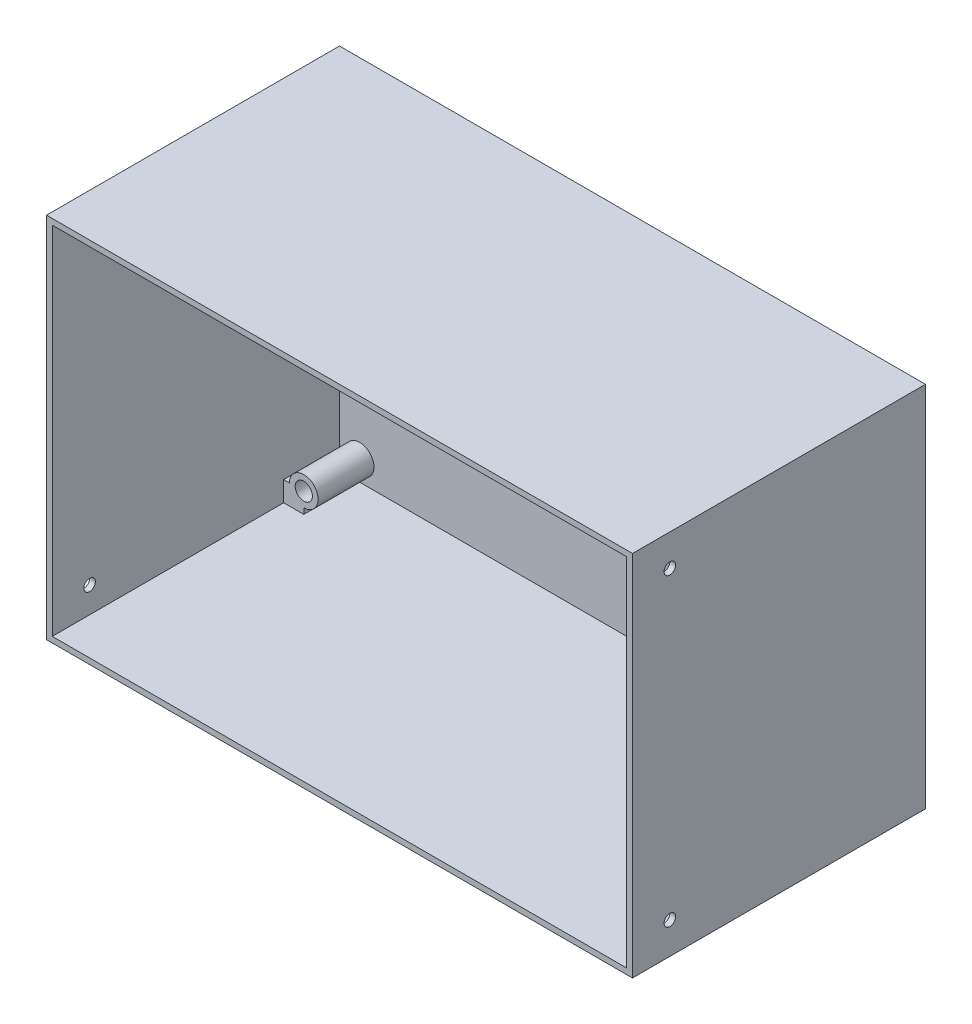
from build123d import *

# Parameters (mm, degrees)
SKETCH_1_W               = 102
SKETCH_1_H               = 64
EXTRUDE_1_DEPTH          = 50
SKETCH_1_3_R             = 1.5
EXTRUDE_2_DEPTH          = 9.72
SKETCH_4_W               = 102
SKETCH_4_H               = 1
EXTRUDE_3_DEPTH          = 64
SKETCH_1_5_W             = 76
SKETCH_1_5_H             = 25.8
CUT_EXTRUDE_1_DEPTH      = 1
CUT_EXTRUDE_2_DEPTH      = 102
CUT_EXTRUDE_2_DEPTH_BACK = 1
SKETCH_5_R               = 1


with BuildPart() as part:
    # Эскиз1 → Бобышка-Вытянуть1 (new body)
    with BuildSketch(Plane.XY):
        with Locations((53, 34)):
            Rectangle(SKETCH_1_W, SKETCH_1_H)
        Polygon((3, 61.5), (3, 65), (6.5, 65), (99.5, 65), (103, 65), (103, 61.5), (103, 6.5), (103, 3), (99.5, 3), (6.5, 3), (3, 3), (3, 6.5), align=None, mode=Mode.SUBTRACT)
    extrude(amount=EXTRUDE_1_DEPTH)

    # Эскиз1<3> → Бобышка-Вытянуть2 (add)
    # profile 1 of 4: a face of its own
    with BuildSketch(Plane.XY):
        with BuildLine():
            Line((6.5, 65), (3, 65))
            Line((3, 65), (3, 61.5))
            Line((3, 61.5), (4, 61.5))
            ThreePointArc((4, 61.5), (8.267766953, 59.732233047), (6.5, 64))
            Line((6.5, 64), (6.5, 65))
        make_face()
        with Locations((6.5, 61.5)):
            Circle(SKETCH_1_3_R, mode=Mode.SUBTRACT)
    # profile 2 of 4: a face of its own
    with BuildSketch(Plane.XY):
        with BuildLine():
            Line((103, 65), (99.5, 65))
            Line((99.5, 65), (99.5, 64))
            ThreePointArc((99.5, 64), (97.732233047, 59.732233047), (102, 61.5))
            Line((102, 61.5), (103, 61.5))
            Line((103, 61.5), (103, 65))
        make_face()
        with Locations((99.5, 61.5)):
            Circle(SKETCH_1_3_R, mode=Mode.SUBTRACT)
    # profile 3 of 4: a face of its own
    with BuildSketch(Plane.XY):
        with BuildLine():
            Line((4, 6.5), (3, 6.5))
            Line((3, 6.5), (3, 3))
            Line((3, 3), (6.5, 3))
            Line((6.5, 3), (6.5, 4))
            ThreePointArc((6.5, 4), (8.267766953, 8.267766953), (4, 6.5))
        make_face()
        with Locations((6.5, 6.5)):
            Circle(SKETCH_1_3_R, mode=Mode.SUBTRACT)
    # profile 4 of 4: a face of its own
    with BuildSketch(Plane.XY):
        with BuildLine():
            Line((103, 3), (103, 6.5))
            Line((103, 6.5), (102, 6.5))
            ThreePointArc((102, 6.5), (97.732233047, 8.267766953), (99.5, 4))
            Line((99.5, 4), (99.5, 3))
            Line((99.5, 3), (103, 3))
        make_face()
        with Locations((99.5, 6.5)):
            Circle(SKETCH_1_3_R, mode=Mode.SUBTRACT)
    extrude(amount=EXTRUDE_2_DEPTH)

    # Эскиз4 → Бобышка-Вытянуть3 (add)
    with BuildSketch(Plane(origin=(0, 66, 0), x_dir=(1, 0, 0), z_dir=(0, 1, 0))):
        with Locations((53, 0.5)):
            Rectangle(SKETCH_4_W, SKETCH_4_H)
    extrude(amount=-EXTRUDE_3_DEPTH)

    # Эскиз1<5> → Вырез-Вытянуть1 (cut)
    with BuildSketch(Plane.XY):
        with Locations((53, 34)):
            Rectangle(SKETCH_1_5_W, SKETCH_1_5_H)
    extrude(amount=-CUT_EXTRUDE_1_DEPTH, mode=Mode.SUBTRACT)

    # Эскиз5 → Вырез-Вытянуть2 (cut, two sides: drawn at the far end of the back side and taken through both)
    with BuildSketch(Plane.ZY.offset(-103).offset(-CUT_EXTRUDE_2_DEPTH_BACK)):
        with Locations((43.5, 7.5)):
            Circle(SKETCH_5_R)
        with Locations((43.5, 60.5)):
            Circle(SKETCH_5_R)
    extrude(amount=CUT_EXTRUDE_2_DEPTH + CUT_EXTRUDE_2_DEPTH_BACK, mode=Mode.SUBTRACT)


solid = part.part
